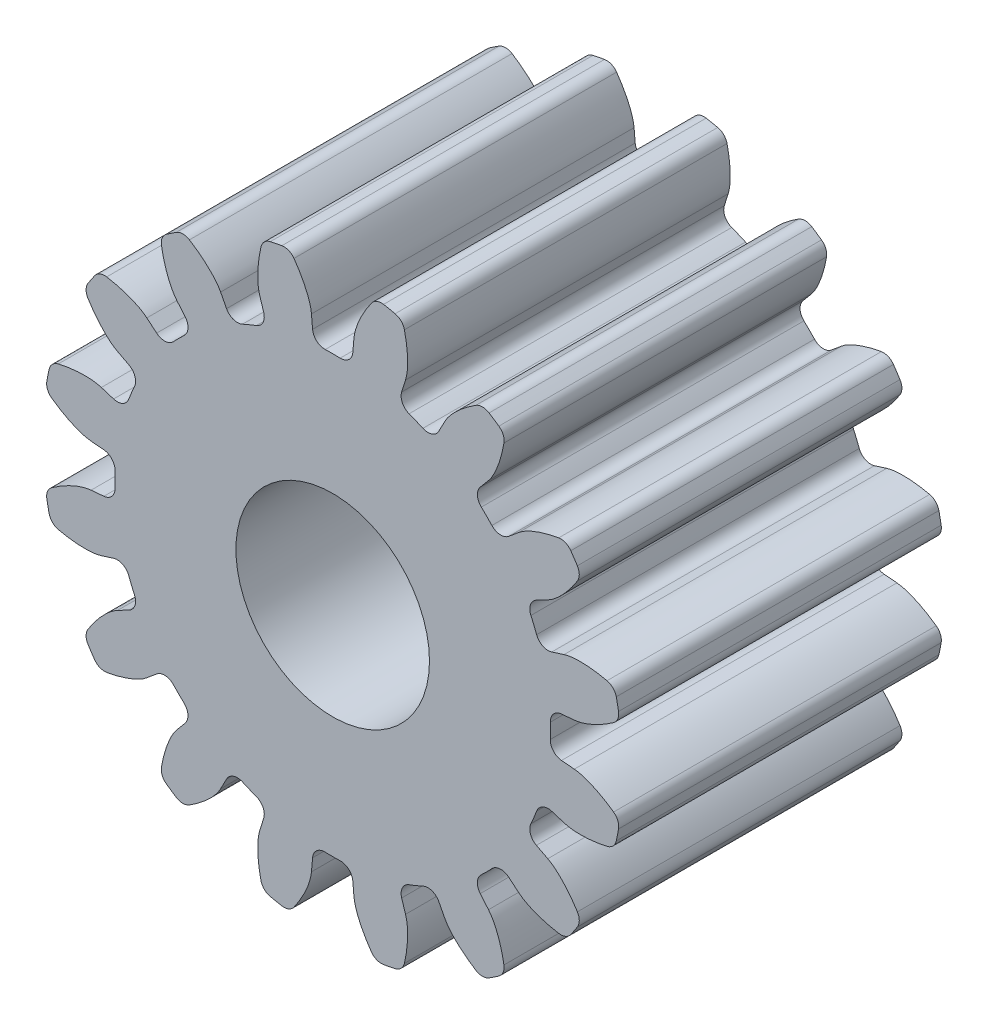
from build123d import *

# Parameters (mm, degrees)
SKETCH_1_R                       = 4.5
SKETCH_1_R_2                     = 1.5
EXTRUDE_1_DEPTH                  = 5
CUT_EXTRUDE_1_DEPTH              = 9.093207028
FILLET_1_R                       = 0.19
PATTERN_CIRCULAR_1_COUNT         = 16
PATTERN_CIRCULAR_1_ANGLE         = 337.5
FILLET_1_OF_PATTERN_CIRCULAR_1_R = 0.19


with BuildPart() as part:
    # 草图1 → 凸台-拉伸1 (new body)
    with BuildSketch(Plane.XY):
        Circle(SKETCH_1_R)
        Circle(SKETCH_1_R_2, mode=Mode.SUBTRACT)
    extrude(amount=EXTRUDE_1_DEPTH)

    # 草图1<3> → 切除-拉伸1 (cut, through all)
    with BuildSketch(Plane.XY):
        with BuildLine():
            Line((3.744337803, 0.329074401), (3.362040897, 0.295475903))
            ThreePointArc((3.362040897, 0.295475903), (3.371758668, 0.147879975), (3.375, 0))
            ThreePointArc((3.375, 0), (3.371758668, -0.147879975), (3.362040897, -0.295475903))
            Line((3.362040897, -0.295475903), (3.744337803, -0.329074401))
            add(Edge.make_bspline(
                [(3.744337803, -0.329074401), (3.772879878, -0.331582846), (3.852010051, -0.344515168), (3.998053748, -0.392622231), (4.176593354, -0.48016265), (4.319250266, -0.572875861), (4.413779393, -0.643953083), (4.449506423, -0.672229565)],
                knots=[0, 0, 0, 0, 0, 0.005604068, 0.015718248, 0.029959916, 0.038889728, 0.038889728, 0.038889728, 0.038889728, 0.038889728], degree=4))
            ThreePointArc((4.449506423, -0.672229565), (4.48735885, -0.337061637), (4.5, 0))
            ThreePointArc((4.5, 0), (4.48735885, 0.337061637), (4.449506423, 0.672229565))
            add(Edge.make_bspline(
                [(3.744337803, 0.329074401), (3.772879878, 0.331582846), (3.852010051, 0.344515168), (3.998053748, 0.392622231), (4.176593354, 0.48016265), (4.319250266, 0.572875861), (4.413779393, 0.643953083), (4.449506423, 0.672229565)],
                knots=[0, 0, 0, 0, 0, 0.005604068, 0.015718248, 0.029959916, 0.038889728, 0.038889728, 0.038889728, 0.038889728, 0.038889728], degree=4))
        make_face()
    cut_extrude_1 = extrude(amount=CUT_EXTRUDE_1_DEPTH, mode=Mode.SUBTRACT)

    # 圆角1
    fillet_1_edges = [part.edges().sort_by_distance(p)[0] for p in [
        (4.449506423, 0.672229565, 2.5),
        (4.449506423, -0.672229565, 2.5),
        (3.362040897, 0.295475903, 2.5),
        (3.362040897, -0.295475903, 2.5),
    ]]
    fillet(fillet_1_edges, radius=FILLET_1_R)

    # 阵列(圆周)1: 切除-拉伸1 ×16 about axis
    pattern_circular_1_axis = Axis((0, 0, 5), (0, 0, 1))
    for i in range(1, PATTERN_CIRCULAR_1_COUNT):
        add(cut_extrude_1.rotate(pattern_circular_1_axis, i * PATTERN_CIRCULAR_1_ANGLE / (PATTERN_CIRCULAR_1_COUNT - 1)), mode=Mode.SUBTRACT)

    # 圆角1 of 阵列(圆周)1
    fillet_1_of_pattern_circular_1_edges = [part.edges().sort_by_distance(p)[0] for p in [
        (3.853556797, 2.323811527, 2.5),
        (4.368059032, 1.081693254, 2.5),
        (2.993047039, 1.559581489, 2.5),
        (3.219194505, 1.013613211, 2.5),
        (2.670938081, 3.621614249, 2.5),
        (3.621614249, 2.670938081, 2.5),
        (2.168388902, 2.586254932, 2.5),
        (2.586254932, 2.168388902, 2.5),
        (1.081693254, 4.368059032, 2.5),
        (2.323811527, 3.853556797, 2.5),
        (1.013613211, 3.219194505, 2.5),
        (1.559581489, 2.993047039, 2.5),
        (-0.672229565, 4.449506423, 2.5),
        (0.672229565, 4.449506423, 2.5),
        (-0.295475903, 3.362040897, 2.5),
        (0.295475903, 3.362040897, 2.5),
        (-2.323811527, 3.853556797, 2.5),
        (-1.081693254, 4.368059032, 2.5),
        (-1.559581489, 2.993047039, 2.5),
        (-1.013613211, 3.219194505, 2.5),
        (-3.621614249, 2.670938081, 2.5),
        (-2.670938081, 3.621614249, 2.5),
        (-2.586254932, 2.168388902, 2.5),
        (-2.168388902, 2.586254932, 2.5),
        (-4.368059032, 1.081693254, 2.5),
        (-3.853556797, 2.323811527, 2.5),
        (-3.219194505, 1.013613211, 2.5),
        (-2.993047039, 1.559581489, 2.5),
        (-4.449506423, -0.672229565, 2.5),
        (-4.449506423, 0.672229565, 2.5),
        (-3.362040897, -0.295475903, 2.5),
        (-3.362040897, 0.295475903, 2.5),
        (-3.853556797, -2.323811527, 2.5),
        (-4.368059032, -1.081693254, 2.5),
        (-2.993047039, -1.559581489, 2.5),
        (-3.219194505, -1.013613211, 2.5),
        (-2.670938081, -3.621614249, 2.5),
        (-3.621614249, -2.670938081, 2.5),
        (-2.168388902, -2.586254932, 2.5),
        (-2.586254932, -2.168388902, 2.5),
        (-1.081693254, -4.368059032, 2.5),
        (-2.323811527, -3.853556797, 2.5),
        (-1.013613211, -3.219194505, 2.5),
        (-1.559581489, -2.993047039, 2.5),
        (0.672229565, -4.449506423, 2.5),
        (-0.672229565, -4.449506423, 2.5),
        (0.295475903, -3.362040897, 2.5),
        (-0.295475903, -3.362040897, 2.5),
        (2.323811527, -3.853556797, 2.5),
        (1.081693254, -4.368059032, 2.5),
        (1.559581489, -2.993047039, 2.5),
        (1.013613211, -3.219194505, 2.5),
        (3.621614249, -2.670938081, 2.5),
        (2.670938081, -3.621614249, 2.5),
        (2.586254932, -2.168388902, 2.5),
        (2.168388902, -2.586254932, 2.5),
        (4.368059032, -1.081693254, 2.5),
        (3.853556797, -2.323811527, 2.5),
        (3.219194505, -1.013613211, 2.5),
        (2.993047039, -1.559581489, 2.5),
    ]]
    fillet(fillet_1_of_pattern_circular_1_edges, radius=FILLET_1_OF_PATTERN_CIRCULAR_1_R)


solid = part.part
